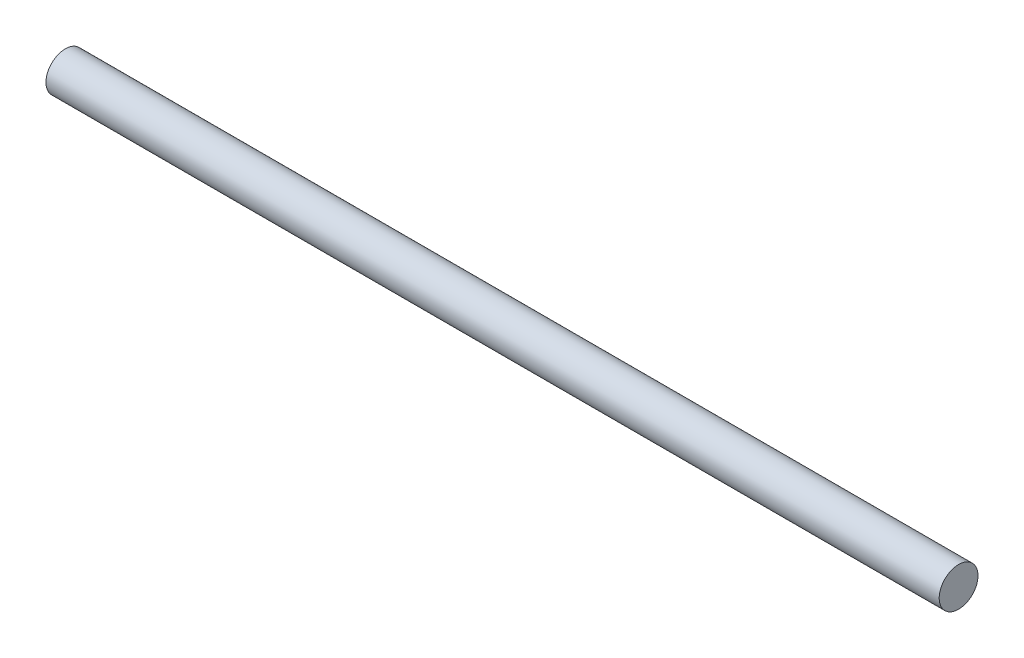
from build123d import *

# Parameters (mm, degrees)
SKETCH1_R           = 0.2921
BOSS_EXTRUDE1_DEPTH = 13.45


with BuildPart() as part:
    # Sketch1 → Boss-Extrude1 (new body)
    with BuildSketch(Plane(origin=(0, 0, 0), x_dir=(0, 0, -1), z_dir=(1, 0, 0))):
        Circle(SKETCH1_R)
    extrude(amount=BOSS_EXTRUDE1_DEPTH)


solid = part.part
